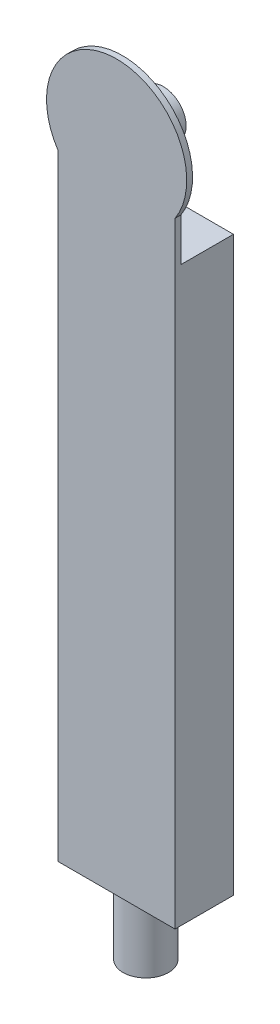
from build123d import *

# Parameters (mm, degrees)
SKETCH2_W           = 20
SKETCH2_H           = 100
BOSS_EXTRUDE1_DEPTH = 10
SKETCH3_R           = 3.9
BOSS_EXTRUDE2_DEPTH = 12
BOSS_EXTRUDE3_DEPTH = 1
SKETCH5_R           = 3.9
BOSS_EXTRUDE4_DEPTH = 7
SKETCH6_W           = 20
SKETCH6_H           = 2
CUT_EXTRUDE1_DEPTH  = 9


with BuildPart() as part:
    # Sketch2 → Boss-Extrude1 (new body)
    with BuildSketch(Plane.XY):
        with Locations((-42.577319588, 46.391752577)):
            Rectangle(SKETCH2_W, SKETCH2_H)
    extrude(amount=BOSS_EXTRUDE1_DEPTH)

    # Sketch3 → Boss-Extrude2 (add)
    with BuildSketch(Plane.XZ.offset(3.608247423)):
        with Locations(Location((-42.577319588, 5, 0), (0, 0, 270))):
            Circle(SKETCH3_R)
    extrude(amount=BOSS_EXTRUDE2_DEPTH)

    # Sketch4 → Boss-Extrude3 (add)
    with BuildSketch(Plane.XY.offset(10)):
        with BuildLine():
            Line((-32.577319588, 96.391752577), (-32.577319588, 101.758502997))
            ThreePointArc((-32.577319588, 101.758502997), (-42.577319588, 120.391752577), (-52.577319588, 101.758502997))
            Line((-52.577319588, 101.758502997), (-52.577319588, 96.391752577))
            Line((-52.577319588, 96.391752577), (-32.577319588, 96.391752577))
        make_face()
    extrude(amount=-BOSS_EXTRUDE3_DEPTH)

    # Sketch5 → Boss-Extrude4 (add)
    with BuildSketch(Plane(origin=(0, 0, 9), x_dir=(-1, 0, 0), z_dir=(0, 0, -1))):
        with Locations(Location((42.577319588, 108.391752577, 0), (0, 0, 180))):
            Circle(SKETCH5_R)
    extrude(amount=BOSS_EXTRUDE4_DEPTH)

    # Sketch6 → Cut-Extrude1 (cut)
    with BuildSketch(Plane(origin=(0, 0, 0), x_dir=(-1, 0, 0), z_dir=(0, 0, -1))):
        with Locations((42.577319588, 95.391752577)):
            Rectangle(SKETCH6_W, SKETCH6_H)
    extrude(amount=-CUT_EXTRUDE1_DEPTH, mode=Mode.SUBTRACT)


solid = part.part
